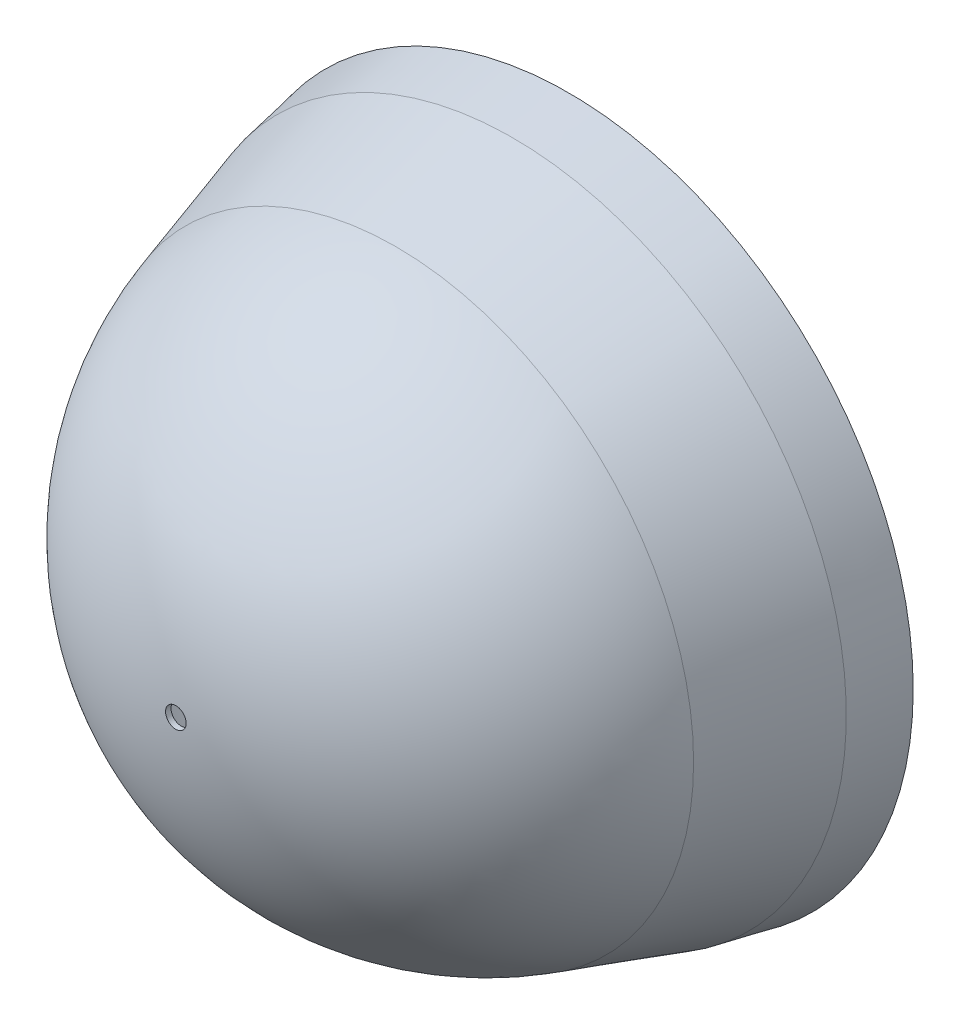
from build123d import *

# Parameters (mm, degrees)
SKETCH7_R          = 2.3876
CUT_EXTRUDE3_DEPTH = 12.7


with BuildPart() as part:
    # Sketch1 → Revolve-Thin1 (revolve)
    with BuildSketch(Plane(origin=(0, 0, 0), x_dir=(0, 0, -1), z_dir=(1, 0, 0)), mode=Mode.PRIVATE) as revolve_thin1_sk:
        with BuildLine():
            ThreePointArc((0, 0), (13.92977193, 42.243362599), (50.254629325, 67.915233681))
            Line((50.254629325, 67.915233681), (77.352878934, 76.2))
            Line((77.352878934, 76.2), (90.052878934, 78.668629926))
            Line((90.052878934, 78.668629926), (103.700637121, 81.321485381))
            ThreePointArc((103.700637121, 81.321485381), (107.388816105, 83.515721298), (108.839, 87.554817996))
            Line((108.839, 87.554817996), (108.839, 114.3))
            Line((108.839, 114.3), (106.299, 114.3))
            Line((106.299, 114.3), (106.299, 87.554817996))
            ThreePointArc((106.299, 87.554817996), (105.428889663, 85.131359977), (103.215982272, 83.814818427))
            Line((103.215982272, 83.814818427), (89.568224085, 81.161962972))
            Line((89.568224085, 81.161962972), (76.737554038, 78.667933362))
            Line((76.737554038, 78.667933362), (49.512005195, 70.344247761))
            ThreePointArc((49.512005195, 70.344247761), (11.887975504, 43.754212477), (-2.54, 0))
            Line((-2.54, 0), (0, 0))
        make_face()
    revolve(revolve_thin1_sk.sketch.rotate(Axis((0, 0, -134.341700673), (0, 0, 1)), 90), axis=Axis((0, 0, -134.341700673), (0, 0, 1)))

    # Sketch5 → Cut-Revolve1 (revolve, cut)
    with BuildSketch(Plane(origin=(0, 0, 0), x_dir=(0, 0, -1), z_dir=(1, 0, 0)), mode=Mode.PRIVATE) as cut_revolve1_sk:
        with BuildLine():
            Line((-1.27, 0), (-23.88640598, 0))
            Line((-23.88640598, 0), (-23.88640598, 127.217845703))
            Line((-23.88640598, 127.217845703), (116.900257224, 127.217845703))
            Line((116.900257224, 127.217845703), (116.900257224, 70.000934593))
            Line((116.900257224, 70.000934593), (90.052878934, 70.000934593))
            Line((90.052878934, 70.000934593), (90.052878934, 79.962400129))
            Line((90.052878934, 79.962400129), (77.045216486, 77.433966681))
            Line((77.045216486, 77.433966681), (49.88331726, 69.129740721))
            ThreePointArc((49.88331726, 69.129740721), (12.908873717, 42.998787538), (-1.27, 0))
        make_face()
    revolve(cut_revolve1_sk.sketch.rotate(Axis((0, 0, -134.341700673), (0, 0, 1)), 90), axis=Axis((0, 0, -134.341700673), (0, 0, 1)), mode=Mode.SUBTRACT)

    # Sketch7 → Cut-Extrude3 (cut, symmetric)
    with BuildSketch(Plane.XY):
        with Locations(Location((0, 0, 0), (0, 0, 90))):
            Circle(SKETCH7_R)
    extrude(amount=CUT_EXTRUDE3_DEPTH, both=True, mode=Mode.SUBTRACT)


solid = part.part
